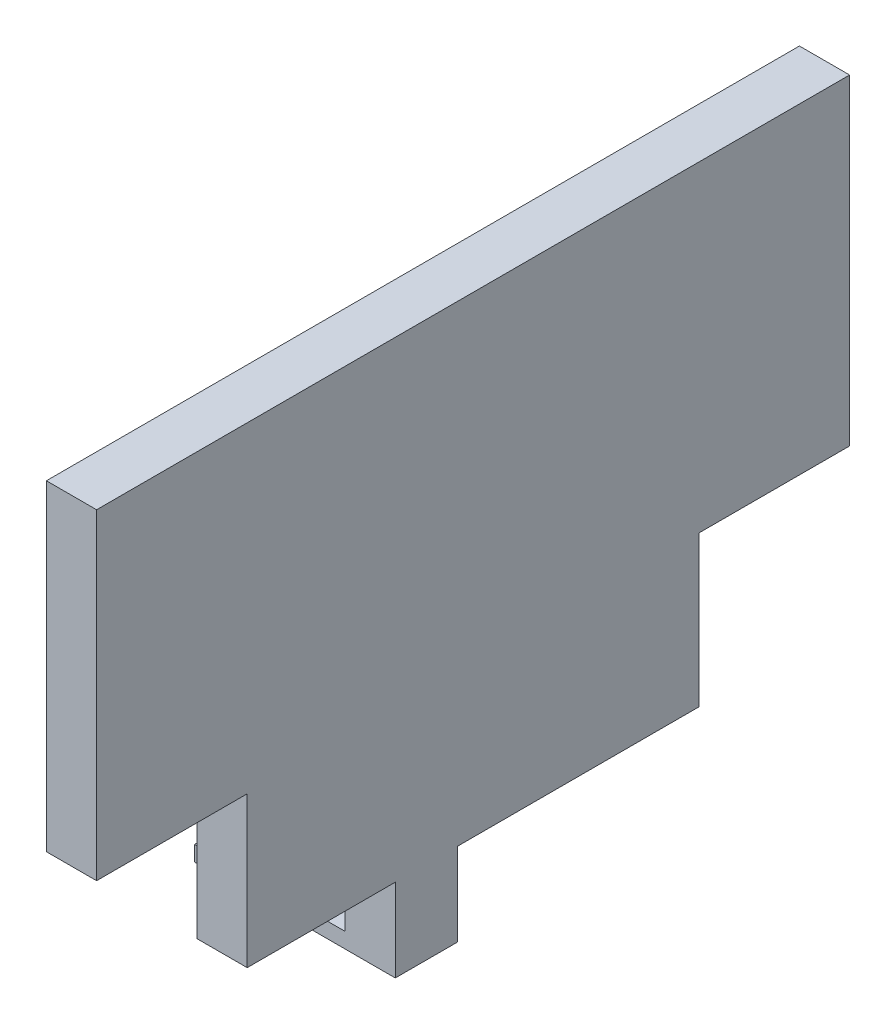
from build123d import *

# Parameters (mm, degrees)
SKETCH1_W           = 12.7
SKETCH1_H           = 119.38
BOSS_EXTRUDE1_DEPTH = 190.5
SKETCH2_W           = 38.1
SKETCH2_H           = 38.1
CUT_EXTRUDE1_DEPTH  = 226.173542851
SKETCH3_W           = 12.7
SKETCH3_H           = 15.677565112
BOSS_EXTRUDE2_DEPTH = 20.9926
SKETCH4_W           = 15.677565112
SKETCH4_H           = 3.864411614
BOSS_EXTRUDE3_DEPTH = 38.1


with BuildPart() as part:
    # Sketch1 → Boss-Extrude1 (new body)
    with BuildSketch(Plane.XY):
        with Locations((-11.213311432, 59.69)):
            Rectangle(SKETCH1_W, SKETCH1_H)
    extrude(amount=BOSS_EXTRUDE1_DEPTH)

    # Sketch2 → Cut-Extrude1 (cut, through all)
    with BuildSketch(Plane.ZY.offset(17.563311432)):
        with Locations((171.45, 19.05)):
            Rectangle(SKETCH2_W, SKETCH2_H)
        with Locations((19.05, 19.05)):
            Rectangle(SKETCH2_W, SKETCH2_H)
    extrude(amount=-CUT_EXTRUDE1_DEPTH, mode=Mode.SUBTRACT)

    # Sketch3 → Boss-Extrude2 (add)
    with BuildSketch(Plane.XZ):
        with Locations((-11.213311432, 107.097101601)):
            Rectangle(SKETCH3_W, SKETCH3_H)
    extrude(amount=BOSS_EXTRUDE2_DEPTH)

    # Sketch4 → Boss-Extrude3 (add)
    with BuildSketch(Plane.ZY.offset(17.563311432)):
        with Locations((107.097101601, -19.060394193)):
            Rectangle(SKETCH4_W, SKETCH4_H)
    extrude(amount=BOSS_EXTRUDE3_DEPTH)


solid = part.part
